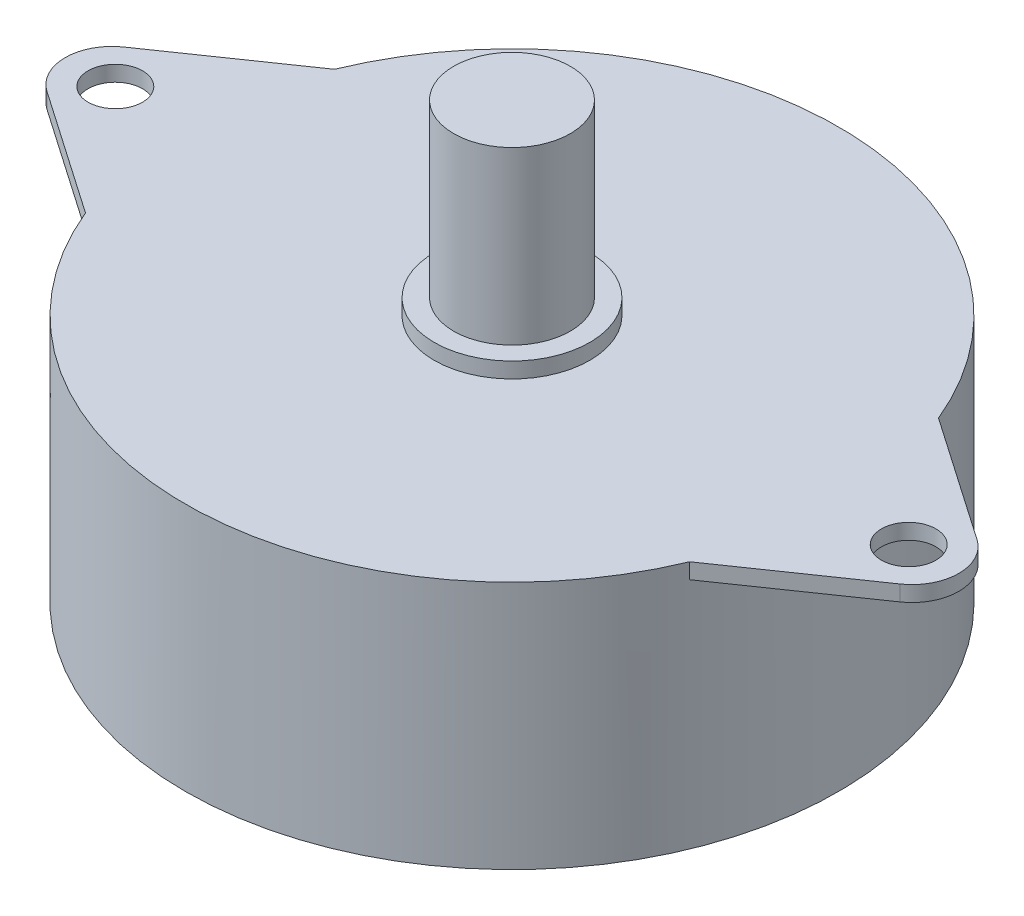
from build123d import *

# Parameters (mm, degrees)
SKETCH1_R      = 21
EXTRUDE1_DEPTH = 16
SKETCH5_R      = 1.75
EXTRUDE2_DEPTH = 1
SKETCH6_R      = 5
EXTRUDE3_DEPTH = 1
SKETCH7_R      = 3.75
EXTRUDE4_DEPTH = 11


with BuildPart() as part:
    # Sketch1 → Extrude1 (new body)
    with BuildSketch(Plane(origin=(0, 0, 0), x_dir=(1, 0, 0), z_dir=(0, 1, 0))):
        with Locations(Location((0, 0, 0), (0, 0, 270))):
            Circle(SKETCH1_R)
    extrude(amount=EXTRUDE1_DEPTH)

    # Sketch5 → Extrude2 (add)
    with BuildSketch(Plane(origin=(0, 16, 0), x_dir=(-1, 0, 0), z_dir=(0, 1, 0))):
        with BuildLine():
            Line((19.416487839, 8), (27.425754866, 2.468505292))
            ThreePointArc((27.425754866, 2.468505292), (28.720914222, 0), (27.425754866, -2.468505292))
            Line((27.425754866, -2.468505292), (19.416487839, -8))
            Line((19.416487839, -8), (-19.416487839, -8))
            Line((-19.416487839, -8), (-27.425754866, -2.468505292))
            ThreePointArc((-27.425754866, -2.468505292), (-28.720914222, 0), (-27.425754866, 2.468505292))
            Line((-27.425754866, 2.468505292), (-19.416487839, 8))
            Line((-19.416487839, 8), (19.416487839, 8))
        make_face()
        with Locations(Location((25.5, 0, 0), (0, 0, 90))):
            Circle(SKETCH5_R, mode=Mode.SUBTRACT)
        with Locations(Location((-25.5, 0, 0), (0, 0, 90))):
            Circle(SKETCH5_R, mode=Mode.SUBTRACT)
    extrude(amount=-EXTRUDE2_DEPTH)

    # Sketch6 → Extrude3 (add)
    with BuildSketch(Plane(origin=(0, 16, 0), x_dir=(-1, 0, 0), z_dir=(0, 1, 0))):
        with Locations(Location((0, 0, 0), (0, 0, 90))):
            Circle(SKETCH6_R)
    extrude(amount=EXTRUDE3_DEPTH)

    # Sketch7 → Extrude4 (add)
    with BuildSketch(Plane(origin=(0, 17, 0), x_dir=(-1, 0, 0), z_dir=(0, 1, 0))):
        with Locations(Location((0, 0, 0), (0, 0, 90))):
            Circle(SKETCH7_R)
    extrude(amount=EXTRUDE4_DEPTH)


solid = part.part
